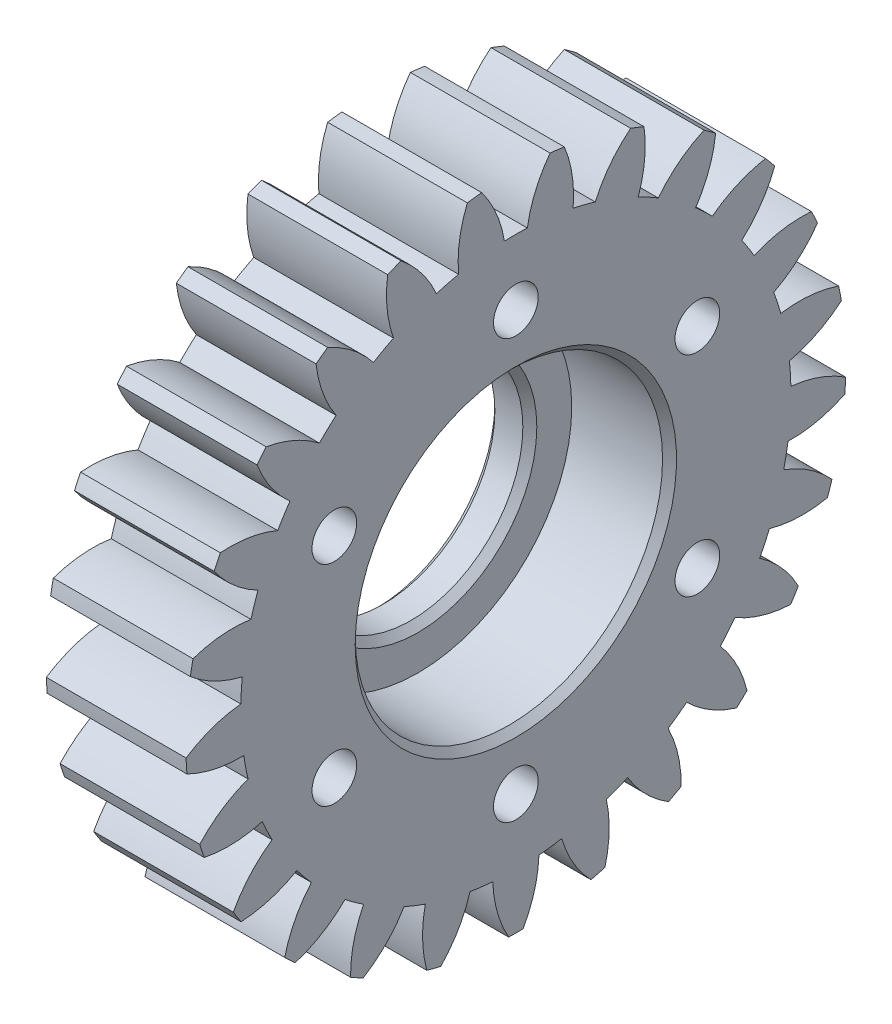
from build123d import *

# Parameters (mm, degrees)
BASPROSKE_W        = 10
BASPROSKE_H        = 23.625
TOOTHCUT_DEPTH     = 35.875224014
TEETHCUTS_COUNT    = 25
TEETHCUTS_ANGLE    = 345.6
BORSKE_R           = 4
BORE_DEPTH         = 50.0000508
SKETCH1_R          = 11
CUT_EXTRUDE1_DEPTH = 7
CUT_EXTRUDE2_REACH = 36.122
SKETCH2_R          = 8
CUT_EXTRUDE3_REACH = 36.862
SKETCH3_R          = 1.6
CIRPATTERN1_COUNT  = 6
CHAMFER1_SIZE      = 0.5


with BuildPart() as part:
    # BasProSke → Base-Revolve (revolve)
    with BuildSketch(Plane(origin=(0, 0, 0), x_dir=(1, 0, 0), z_dir=(0, 1, 0)), mode=Mode.PRIVATE) as base_revolve_sk:
        with Locations((5, 11.8125)):
            Rectangle(BASPROSKE_W, BASPROSKE_H)
    revolve(base_revolve_sk.sketch.rotate(Axis((-10, 0, 0), (1, 0, 0)), 180), axis=Axis((-10, 0, 0), (1, 0, 0)))

    # TooCutSke → ToothCut (cut, through all)
    with BuildSketch(Plane(origin=(0, 0, 0), x_dir=(0, 0, -1), z_dir=(1, 0, 0))):
        with BuildLine():
            ThreePointArc((0.818998709, 19.669456611), (0, 19.6865), (-0.818998709, 19.669456611))
            ThreePointArc((-0.818998709, 19.669456611), (-1.409254574, 21.695516899), (-2.467415344, 23.521336732))
            ThreePointArc((-2.467415344, 23.521336732), (0, 23.6504), (2.467415344, 23.521336732))
            ThreePointArc((2.467415344, 23.521336732), (1.409254574, 21.695516899), (0.818998709, 19.669456611))
        make_face()
    toothcut = extrude(amount=TOOTHCUT_DEPTH, mode=Mode.SUBTRACT)

    # TeethCuts: ToothCut ×25 about axis
    teethcuts_axis = Axis((-10, 0, 0), (1, 0, 0))
    for i in range(1, TEETHCUTS_COUNT):
        add(toothcut.rotate(teethcuts_axis, i * TEETHCUTS_ANGLE / (TEETHCUTS_COUNT - 1)), mode=Mode.SUBTRACT)

    # BorSke → Bore (cut, symmetric)
    with BuildSketch(Plane(origin=(0, 0, 0), x_dir=(0, 0, -1), z_dir=(1, 0, 0))):
        with Locations(Location((0, 0, 0), (0, 0, 180))):
            Circle(BORSKE_R)
    extrude(amount=BORE_DEPTH, both=True, mode=Mode.SUBTRACT)

    # Sketch1 → Cut-Extrude1 (cut)
    with BuildSketch(Plane(origin=(10, 0, 0), x_dir=(0, 0, -1), z_dir=(1, 0, 0))):
        Circle(SKETCH1_R)
    extrude(amount=-CUT_EXTRUDE1_DEPTH, mode=Mode.SUBTRACT)

    # Sketch2 → Cut-Extrude2 (cut, up to next)
    with BuildSketch(Plane(origin=(3, 0, 0), x_dir=(0, 0, -1), z_dir=(1, 0, 0)), mode=Mode.PRIVATE) as cut_extrude2_sk1:
        Circle(SKETCH2_R)
    cut_extrude2_tool1 = extrude(cut_extrude2_sk1.sketch, amount=-CUT_EXTRUDE2_REACH, mode=Mode.PRIVATE) & part.part
    add(cut_extrude2_tool1.solids().sort_by_distance((3, 0, 0))[0], mode=Mode.SUBTRACT)

    # Sketch3 → Cut-Extrude3 (cut, up to next)
    with BuildSketch(Plane(origin=(10, 0, 0), x_dir=(0, 0, -1), z_dir=(1, 0, 0)), mode=Mode.PRIVATE) as cut_extrude3_sk1:
        with Locations((0, 15)):
            Circle(SKETCH3_R)
    cut_extrude3_tool1 = extrude(cut_extrude3_sk1.sketch, amount=-CUT_EXTRUDE3_REACH, mode=Mode.PRIVATE) & part.part
    cut_extrude3 = cut_extrude3_tool1.solids().sort_by_distance((10, 15, 0))[0]
    add(cut_extrude3, mode=Mode.SUBTRACT)

    # CirPattern1: Cut-Extrude3 ×6 about axis
    cirpattern1_axis = Axis((0, 0, 0), (1, 0, 0))
    for i in range(1, CIRPATTERN1_COUNT):
        add(cut_extrude3.rotate(cirpattern1_axis, i * 360 / CIRPATTERN1_COUNT), mode=Mode.SUBTRACT)

    # Chamfer1
    chamfer1_edges = [part.edges().sort_by_distance(p)[0] for p in [
        (10, 0, 11),
        (3, 0, 8),
        (0, 0, 8),
    ]]
    chamfer(chamfer1_edges, length=CHAMFER1_SIZE)


solid = part.part
